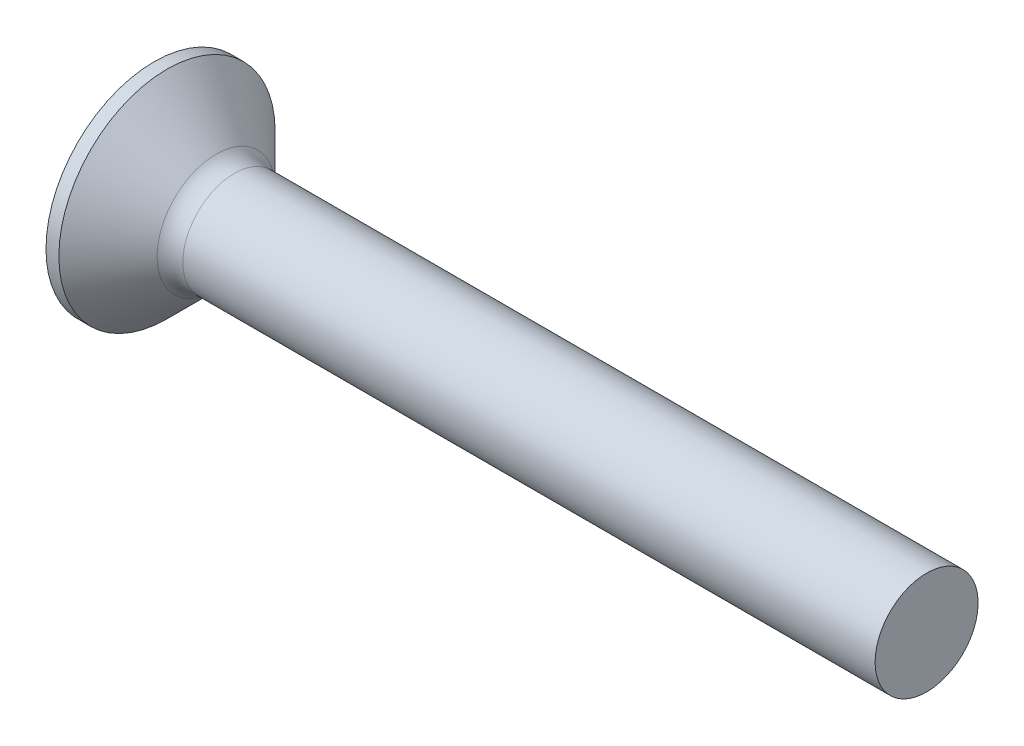
from build123d import *

# Parameters (mm, degrees)
FILLET1_R    = 1
RECPAT_COUNT = 2
RECPAT_ANGLE = 90


with BuildPart() as part:
    # BodySke → Base-Revolve (revolve)
    with BuildSketch(Plane.XY, mode=Mode.PRIVATE) as base_revolve_sk:
        with BuildLine():
            Line((0, 0), (31, 0))
            Line((31, 0), (31, 2))
            Line((31, 2), (3.7, 2))
            Line((3.7, 2), (1.5, 4.2))
            Line((1.5, 4.2), (1, 4.2))
            ThreePointArc((1, 4.2), (0.253446079, 2.158703314), (0, 0))
        make_face()
    revolve(base_revolve_sk.sketch.rotate(Axis((-15.875, 0, 0), (1, 0, 0)), 90), axis=Axis((-15.875, 0, 0), (1, 0, 0)))

    # Fillet1
    fillet1_edges = [part.edges().sort_by_distance(p)[0] for p in [
        (3.7, 0, -2),
    ]]
    fillet(fillet1_edges, radius=FILLET1_R)

    # Sketch3 → Recess section 0
    with BuildSketch(Plane(origin=(0, 0, 0), x_dir=(0, 0, -1), z_dir=(1, 0, 0))):
        with BuildLine():
            Line((0.515, -2.5), (-0.515, -2.5))
            Line((-0.515, -2.5), (-0.515, 2.5))
            Line((-0.515, 2.5), (0.515, 2.5))
            Line((0.515, 2.5), (0.515, -2.5))
        make_face()
    # Sketch4 → Recess section 1
    with BuildSketch(Plane(origin=(3.1, 0, 0), x_dir=(0, 0, -1), z_dir=(1, 0, 0))):
        with BuildLine():
            Line((0.515, -0.954397274), (-0.515, -0.954397274))
            Line((-0.515, -0.954397274), (-0.515, 0.954397274))
            Line((-0.515, 0.954397274), (0.515, 0.954397274))
            Line((0.515, 0.954397274), (0.515, -0.954397274))
        make_face()
    recess = loft(mode=Mode.SUBTRACT)

    # RecPat: Recess ×2 about axis
    recpat_axis = Axis((0, 0, 0), (1, 0, 0))
    for i in range(1, RECPAT_COUNT):
        add(recess.rotate(recpat_axis, i * RECPAT_ANGLE / (RECPAT_COUNT - 1)), mode=Mode.SUBTRACT)

    # RecCorSke → RecessCore (revolve, cut)
    with BuildSketch(Plane.XY, mode=Mode.PRIVATE) as recesscore_sk:
        Polygon((0, 0), (0, 1.067773117), (3.1, 0.851), (3.376506661, 0), align=None)
    revolve(recesscore_sk.sketch.rotate(Axis((-3.175, 0, 0), (1, 0, 0)), 90), axis=Axis((-3.175, 0, 0), (1, 0, 0)), mode=Mode.SUBTRACT)


solid = part.part
